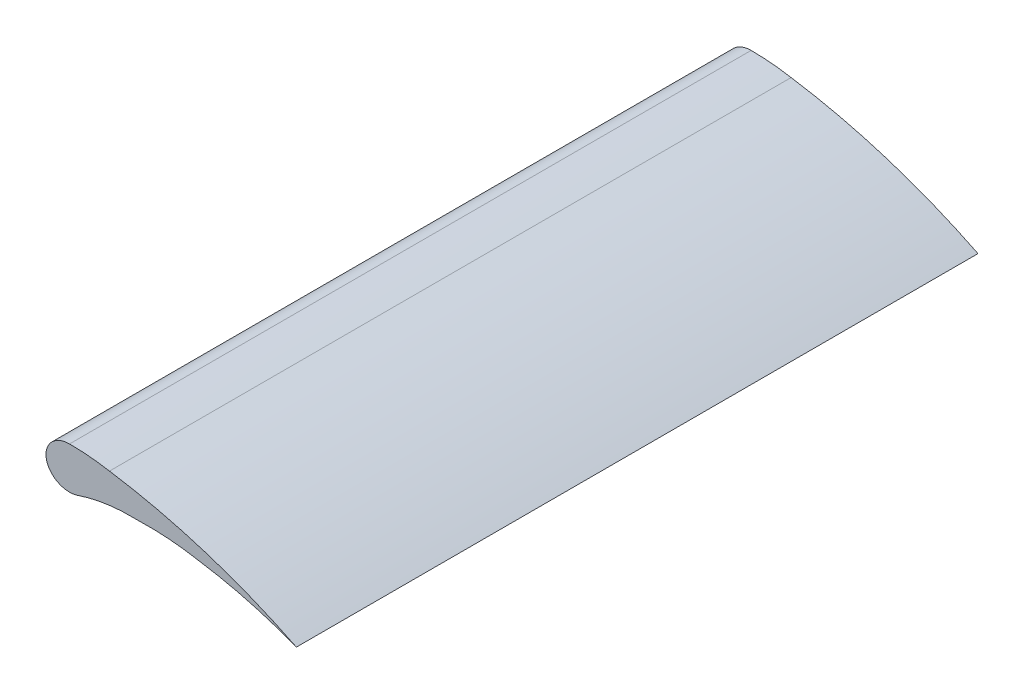
from build123d import *

# Parameters (mm, degrees)
BOSS_EXTRUDE1_DEPTH = 127


with BuildPart() as part:
    # Sketch1 → Boss-Extrude1 (new body)
    with BuildSketch(Plane.XY):
        with BuildLine():
            ThreePointArc((5.988243306, 4.142742921), (11.024678198, 5.355780535), (16.193760647, 5.698888847))
            ThreePointArc((16.193760647, 5.698888847), (16.814968634, 5.694834381), (17.436089981, 5.705973204))
            ThreePointArc((17.436089981, 5.705973204), (22.995437823, 5.574927799), (28.508665293, 4.848398936))
            ThreePointArc((28.508665293, 4.848398936), (37.717422449, 2.933698953), (46.65390357, 0))
            ThreePointArc((46.65390357, 0), (29.664168833, 6.833678163), (11.831268851, 10.997561194))
            ThreePointArc((11.831268851, 10.997561194), (8.120623479, 11.488041597), (4.381292956, 11.6519542))
            add(Edge.make_bspline(
                [(4.381292956, 11.6519542), (-0.910871483, 11.6519542), (0.077010398, 7.035623795), (1.064892278, 2.419293389), (5.988243306, 4.142742921)],
                knots=[4.71238898, 4.71238898, 4.71238898, 6.470955534, 6.470955534, 8.229522087, 8.229522087, 8.229522087], degree=2, weights=[1, 0.637703387, 1, 0.637703387, 1]))
        make_face()
    extrude(amount=-BOSS_EXTRUDE1_DEPTH)


solid = part.part
